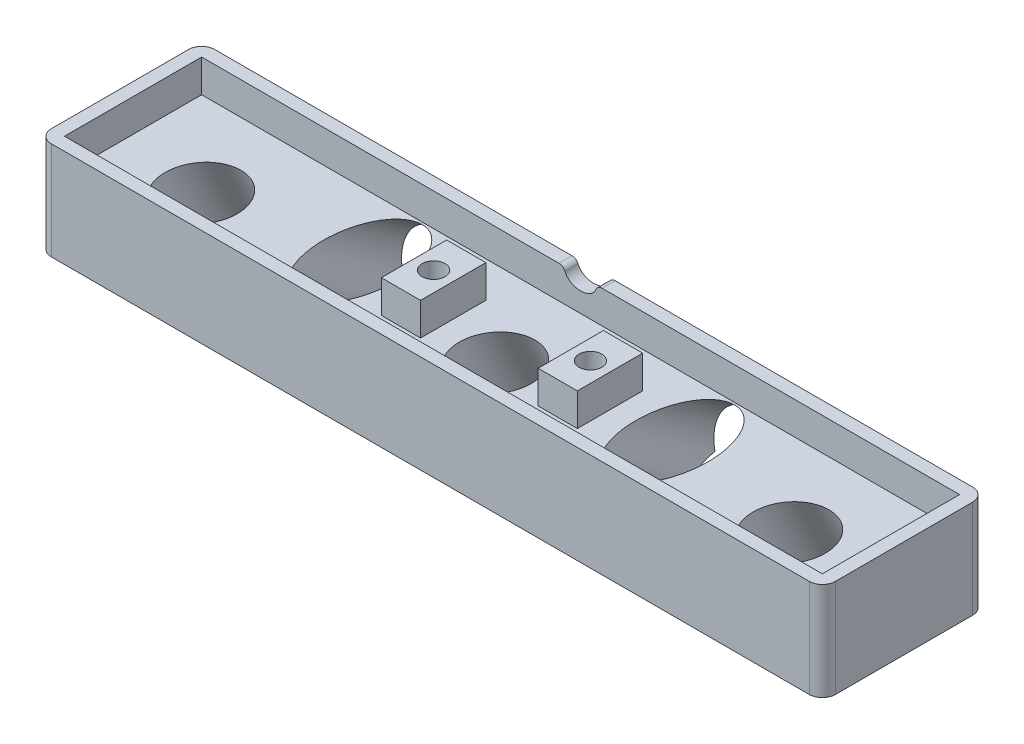
from build123d import *

# Parameters (mm, degrees)
BASE_W                 = 120
BASE_H                 = 25
BASE_EXT_DEPTH         = 10
SKETCH3_R              = 5.5
LED_BOTTOM_CUT_DEPTH   = 65.13752525
LED_FOR_TOP_ROW_R      = 5.5
LED_TOP_CUT_DEPTH      = 66.86811155
SKETCH5_W              = 120
SKETCH5_H              = 25
SKETCH5_W_2            = 116
SKETCH5_H_2            = 21
WIRE_BOX_RIM_DEPTH     = 5
SKETCH6_W              = 6
SKETCH6_H              = 10
SUPPORT_SPACERS_DEPTH  = 5
SKETCH8_R              = 1.75
M3_SCREW_CUT_DEPTH     = 64.097147321
WIRE_CUT_OUT_RX        = 2.5
WIRE_CUT_OUT_RY        = 2
WIRE_CUT_OUT_CUT_DEPTH = 2
FILLET1_R              = 1
FILLET2_R              = 1
FILLET3_R              = 2
FILLET4_R              = 2
FILLET5_R              = 2
FILLET6_R              = 2
CUT_EXTRUDE5_DEPTH     = 3.5


with BuildPart() as part:
    # Base → Base EXT (new body)
    with BuildSketch(Plane(origin=(0, 0, 0), x_dir=(1, 0, 0), z_dir=(0, 1, 0))):
        Rectangle(BASE_W, BASE_H)
    extrude(amount=BASE_EXT_DEPTH)

    # Sketch3 → LED bottom CUT (cut, through all)
    with BuildSketch(Plane(origin=(0, 13.001715818, 6.062799655), x_dir=(1, 0, 0), z_dir=(0, 0.9063077870366496, 0.4226182617407003))):
        with Locations(Location((-45, 1.897335279, 0), (0, 0, 270))):
            Circle(SKETCH3_R)
        with Locations(Location((0, 1.897335279, 0), (0, 0, 270))):
            Circle(SKETCH3_R)
        with Locations(Location((45, 1.897335279, 0), (0, 0, 270))):
            Circle(SKETCH3_R)
    extrude(amount=-LED_BOTTOM_CUT_DEPTH, mode=Mode.SUBTRACT)

    # LED for Top Row → LED top CUT (cut, through all)
    with BuildSketch(Plane(origin=(0, 9.162978163, 13.086089), x_dir=(1, 0, 0), z_dir=(0, 0.5735764363510444, 0.819152044288993))):
        with Locations(Location((-23.903258736, 8.521814989, 0), (0, 0, 270))):
            Circle(LED_FOR_TOP_ROW_R)
        with Locations(Location((23.903258736, 8.521814989, 0), (0, 0, 270))):
            Circle(LED_FOR_TOP_ROW_R)
    extrude(amount=-LED_TOP_CUT_DEPTH, mode=Mode.SUBTRACT)

    # Sketch5 → Wire Box Rim (add)
    with BuildSketch(Plane(origin=(0, 10, 0), x_dir=(1, 0, 0), z_dir=(0, 1, 0))):
        Rectangle(SKETCH5_W, SKETCH5_H)
        Rectangle(SKETCH5_W_2, SKETCH5_H_2, mode=Mode.SUBTRACT)
    extrude(amount=WIRE_BOX_RIM_DEPTH)

    # Sketch6 → Support Spacers (add)
    with BuildSketch(Plane(origin=(0, 10, 0), x_dir=(1, 0, 0), z_dir=(0, 1, 0))):
        with Locations((-12, 0)):
            Rectangle(SKETCH6_W, SKETCH6_H)
        with Locations((12, 0)):
            Rectangle(SKETCH6_W, SKETCH6_H)
    extrude(amount=SUPPORT_SPACERS_DEPTH)

    # Sketch8 → M3 Screw CUT (cut, through all)
    with BuildSketch(Plane(origin=(0, 15, 0), x_dir=(1, 0, 0), z_dir=(0, 1, 0))):
        with Locations(Location((12, 0, 0), (0, 0, 270))):
            Circle(SKETCH8_R)
        with Locations(Location((-12, 0, 0), (0, 0, 270))):
            Circle(SKETCH8_R)
    extrude(amount=-M3_SCREW_CUT_DEPTH, mode=Mode.SUBTRACT)

    # Wire cut out → Wire cut out CUT (cut)
    with BuildSketch(Plane(origin=(0, 0, -12.5), x_dir=(-1, 0, 0), z_dir=(0, 0, -1))):
        with Locations(Location((0, 15), (0, 0, 180))):
            Ellipse(WIRE_CUT_OUT_RX, WIRE_CUT_OUT_RY)
    extrude(amount=-WIRE_CUT_OUT_CUT_DEPTH, mode=Mode.SUBTRACT)

    # Fillet1
    fillet1_edges = [part.edges().sort_by_distance(p)[0] for p in [
        (2.5, 15, -11.5),
    ]]
    fillet(fillet1_edges, radius=FILLET1_R)

    # Fillet2
    fillet2_edges = [part.edges().sort_by_distance(p)[0] for p in [
        (-2.5, 15, -11.5),
    ]]
    fillet(fillet2_edges, radius=FILLET2_R)

    # Fillet3
    fillet3_edges = [part.edges().sort_by_distance(p)[0] for p in [
        (-60, 7.5, -12.5),
    ]]
    fillet(fillet3_edges, radius=FILLET3_R)

    # Fillet4
    fillet4_edges = [part.edges().sort_by_distance(p)[0] for p in [
        (60, 7.5, -12.5),
    ]]
    fillet(fillet4_edges, radius=FILLET4_R)

    # Fillet5
    fillet5_edges = [part.edges().sort_by_distance(p)[0] for p in [
        (60, 7.5, 12.5),
    ]]
    fillet(fillet5_edges, radius=FILLET5_R)

    # Fillet6
    fillet6_edges = [part.edges().sort_by_distance(p)[0] for p in [
        (-60, 7.5, 12.5),
    ]]
    fillet(fillet6_edges, radius=FILLET6_R)

    # M3 Nut → Cut-Extrude5 (cut)
    with BuildSketch(Plane.XZ):
        Polygon((-12, 3.175426481), (-14.75, 1.58771324), (-14.75, -1.58771324), (-12, -3.175426481), (-9.25, -1.58771324), (-9.25, 1.58771324), align=None)
        Polygon((9.25, 1.58771324), (12, 3.175426481), (14.75, 1.58771324), (14.75, -1.58771324), (12, -3.175426481), (9.25, -1.58771324), align=None)
    extrude(amount=-CUT_EXTRUDE5_DEPTH, mode=Mode.SUBTRACT)


solid = part.part
